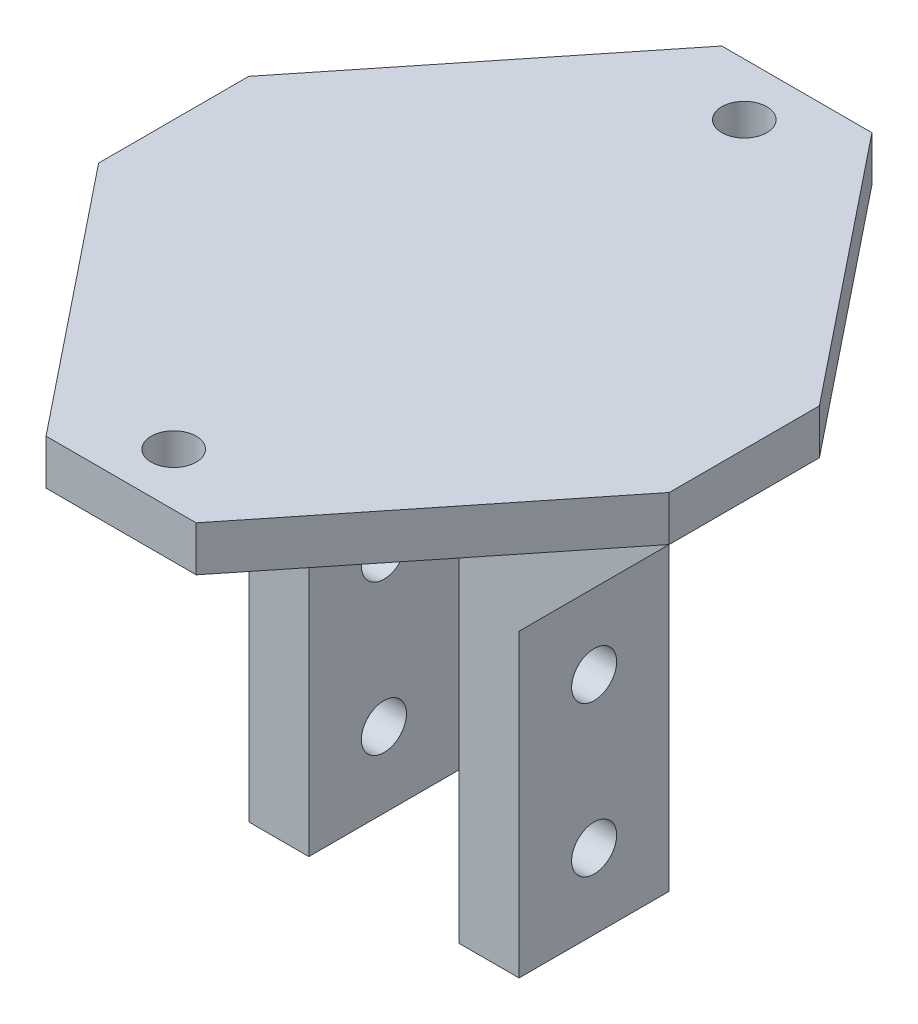
from build123d import *

# Parameters (mm, degrees)
SKETCH_1_W            = 38
SKETCH_1_H            = 45
EXTRUDE_1_DEPTH       = 3
EXTRUDE_2_DEPTH       = 10
HOLE_WIZARD_3_0_3_1_D = 3
HOLE_WIZARD_3_0_3_2_D = 3
CUT_EXTRUDE_1_DEPTH   = 200
MIRROR_3_COPY_1_DEPTH = 200


with BuildPart() as part:
    # 草图1 → 凸台-拉伸1 (new body)
    with BuildSketch(Plane(origin=(0, 0, 0), x_dir=(1, 0, 0), z_dir=(0, 1, 0))):
        Rectangle(SKETCH_1_W, SKETCH_1_H)
    extrude(amount=EXTRUDE_1_DEPTH)

    # 草图3 → 凸台-拉伸2 (add)
    with BuildSketch(Plane(origin=(0, 0, -5), x_dir=(1, 0, 0), z_dir=(0, 0, -1))):
        Polygon((-5, 0), (-5, 30), (-9, 30), (-9, 10), (-19, 0), align=None)
    extrude_2 = extrude(amount=-EXTRUDE_2_DEPTH)

    # 镜向1: 凸台-拉伸2 across plane
    add(extrude_2.mirror(Plane(origin=(0, 0, 0), x_dir=(0, 0, 1), z_dir=(1, 0, 0))))

    # Ø3.0 (3) 直径孔1 (through all)
    with Locations(Plane(origin=(0, 0, 0), x_dir=(-1, 0, 0), z_dir=(0, -1, 0))):
        with Locations((0, -19), (0, 19)):
            Hole(HOLE_WIZARD_3_0_3_1_D / 2)

    # Ø3.0 (3) 直径孔2 (through all)
    with Locations(Plane(origin=(9, 0, 0), x_dir=(0, 0, -1), z_dir=(1, 0, 0))):
        with Locations((0, -25), (0, -15)):
            Hole(HOLE_WIZARD_3_0_3_2_D / 2)

    # 草图8 → 切除-拉伸1 (cut)
    with BuildSketch(Plane(origin=(0, 0, 0), x_dir=(-1, 0, 0), z_dir=(0, -1, 0))):
        Polygon((19, -5), (5, -22.5), (19, -22.5), align=None)
    cut_extrude_1 = extrude(amount=-CUT_EXTRUDE_1_DEPTH, mode=Mode.SUBTRACT)

    # 镜向2: 切除-拉伸1 across plane
    add(cut_extrude_1.mirror(Plane(origin=(0, 0, 0), x_dir=(0, 0, 1), z_dir=(1, 0, 0))), mode=Mode.SUBTRACT)

    # 镜向3: 切除-拉伸1 across plane
    add(cut_extrude_1.mirror(Plane(origin=(0, 0, 0), x_dir=(1, 0, 0), z_dir=(0, 0, -1))), mode=Mode.SUBTRACT)

    # 镜向3 copy 1 sketch → 镜向3 copy 1 (cut)
    with BuildSketch(Plane.XZ):
        Polygon((19, -5), (5, -22.5), (19, -22.5), align=None)
    extrude(amount=-MIRROR_3_COPY_1_DEPTH, mode=Mode.SUBTRACT)


solid = part.part
